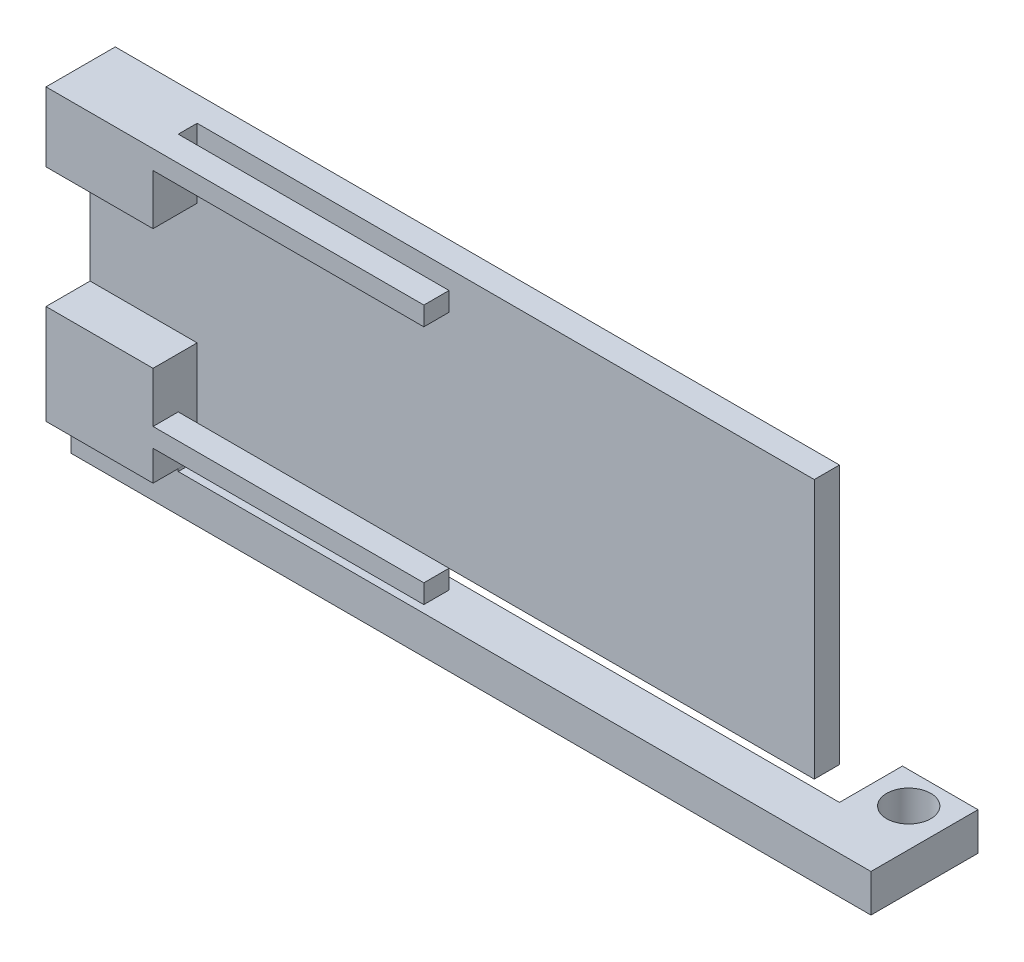
from build123d import *

# Parameters (mm, degrees)
ESBO_O1_W                 = 52.5
ESBO_O1_H                 = 20.6
RESSALTO_EXTRUS_O1_DEPTH  = 2
ESBO_O2_W                 = 3.5
ESBO_O2_H                 = 20.6
RESSALTO_EXTRUS_O2_DEPTH  = 3.5
ESBO_O3_W                 = 3.5
ESBO_O3_H                 = 9.6
CORTE_EXTRUS_O1_DEPTH     = 3.5
ESBO_O4_W                 = 2
ESBO_O4_H                 = 1.5
RESSALTO_EXTRUS_O3_DEPTH  = 21.5
RESSALTO_EXTRUS_O4_DEPTH  = 2
ESBO_O9_W                 = 5
ESBO_O9_H                 = 5.5
RESSALTO_EXTRUS_O8_DEPTH  = 3.5
RESSALTO_EXTRUS_O9_DEPTH  = 3.5
ESBO_O11_W                = 8.5
ESBO_O11_H                = 3
ESBO_O11_W_2              = 6
RESSALTO_EXTRUS_O10_DEPTH = 5
ESBO_O12_R                = 1.75
CORTE_EXTRUS_O2_DEPTH     = 5


with BuildPart() as part:
    # Esboço1 → Ressalto-extrusão1 (new body)
    with BuildSketch(Plane.XY):
        with Locations((6.666541047, -2.313135593)):
            Rectangle(ESBO_O1_W, ESBO_O1_H)
    extrude(amount=RESSALTO_EXTRUS_O1_DEPTH)

    # Esboço2 → Ressalto-extrusão2 (add)
    with BuildSketch(Plane.XY.offset(2)):
        with Locations((-17.833458953, -2.313135593)):
            Rectangle(ESBO_O2_W, ESBO_O2_H)
    extrude(amount=RESSALTO_EXTRUS_O2_DEPTH)

    # Esboço3 → Corte-extrusão1 (cut)
    with BuildSketch(Plane.XY.offset(5.5)):
        with Locations((-17.833458953, -2.313135593)):
            Rectangle(ESBO_O3_W, ESBO_O3_H)
    extrude(amount=-CORTE_EXTRUS_O1_DEPTH, mode=Mode.SUBTRACT)

    # Esboço4 → Ressalto-extrusão3 (add)
    with BuildSketch(Plane(origin=(-16.083458953, 0, 0), x_dir=(0, 0, -1), z_dir=(1, 0, 0))):
        with Locations((-4.5, 7.236864407)):
            Rectangle(ESBO_O4_W, ESBO_O4_H)
        with Locations((-4.5, -11.863135593)):
            Rectangle(ESBO_O4_W, ESBO_O4_H)
    extrude(amount=RESSALTO_EXTRUS_O3_DEPTH)

    # Esboço5 → Ressalto-extrusão4 (add)
    with BuildSketch(Plane.XY.offset(2)):
        Polygon((-19.583458953, 7.986864407), (-24.583458953, 7.986864407), (-24.583458953, -12.613135593), (-24.583458953, -15.013135593), (-16.083458953, -15.013135593), (-16.083458953, -12.613135593), (-19.583458953, -12.613135593), align=None)
    extrude(amount=-RESSALTO_EXTRUS_O4_DEPTH)

    # Esboço9 → Ressalto-extrusão8 (add, through all)
    with BuildSketch(Plane.XY.offset(2)):
        Polygon((-19.583458953, -7.113135593), (-24.583458953, -7.113135593), (-24.583458953, -15.013135593), (-16.083458953, -15.013135593), (-16.083458953, -12.613135593), (-19.583458953, -12.613135593), align=None)
        with Locations((-22.083458953, 5.236864407)):
            Rectangle(ESBO_O9_W, ESBO_O9_H)
    extrude(amount=RESSALTO_EXTRUS_O8_DEPTH)


with BuildPart() as body_2:
    # Esboço10 → Ressalto-extrusão9 (new, through all)
    with BuildSketch(Plane(origin=(0, 0, 3.5), x_dir=(-1, 0, 0), z_dir=(0, 0, -1))):
        Polygon((16.083458953, -15.213135593), (-38.916541047, -15.213135593), (-38.916541047, -18.213135593), (24.583458953, -18.213135593), (24.583458953, -15.213135593), (24.583458953, -15.013135593), (16.083458953, -15.013135593), align=None)
    extrude(amount=RESSALTO_EXTRUS_O9_DEPTH)

    # Esboço11 → Ressalto-extrusão10 (add)
    with BuildSketch(Plane(origin=(0, 0, 0), x_dir=(-1, 0, 0), z_dir=(0, 0, -1))):
        with Locations((20.333458953, -16.713135593)):
            Rectangle(ESBO_O11_W, ESBO_O11_H)
        with Locations((-35.916541047, -16.713135593)):
            Rectangle(ESBO_O11_W_2, ESBO_O11_H)
    extrude(amount=RESSALTO_EXTRUS_O10_DEPTH)

    # Esboço12 → Corte-extrusão2 (cut)
    with BuildSketch(Plane(origin=(0, -15.213135593, 0), x_dir=(1, 0, 0), z_dir=(0, 1, 0))):
        with Locations(Location((35.916541047, 2.5, 0), (0, 0, 270))):
            Circle(ESBO_O12_R)
        with Locations(Location((-20.333458953, 2.5, 0), (0, 0, 270))):
            Circle(ESBO_O12_R)
    extrude(amount=-CORTE_EXTRUS_O2_DEPTH, mode=Mode.SUBTRACT)


solid = Compound([part.part, body_2.part])
